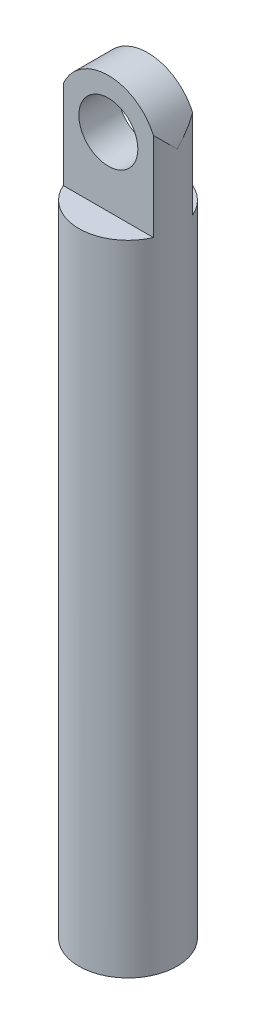
from build123d import *

# Parameters (mm, degrees)
SKETCH_1_R               = 2.5
EXTRUDE_1_DEPTH          = 38.5
CUT_EXTRUDE_1_DEPTH      = 39.661996844
CUT_EXTRUDE_1_DEPTH_BACK = 39.661996844
CUT_EXTRUDE_2_DEPTH      = 39.661996957
CUT_EXTRUDE_2_DEPTH_BACK = 39.661996957
SKETCH_3_W               = 1.5
SKETCH_3_H               = 6


with BuildPart() as part:
    # 草图1 → 凸台-拉伸1 (new body)
    with BuildSketch(Plane(origin=(0, 0, 0), x_dir=(1, 0, 0), z_dir=(0, 1, 0))):
        with Locations(Location((0, 0, 0), (0, 0, 270))):
            Circle(SKETCH_1_R)
    extrude(amount=EXTRUDE_1_DEPTH)

    # 草图2 → 切除-拉伸1 (cut, two sides: drawn at the far end of the back side and taken through both)
    with BuildSketch(Plane.XY.offset(-CUT_EXTRUDE_1_DEPTH_BACK)):
        with BuildLine():
            ThreePointArc((-2.5, 36), (-1.767766953, 37.767766953), (0, 38.5))
            Line((0, 38.5), (-2.5, 38.5))
            Line((-2.5, 38.5), (-2.5, 36))
        make_face()
        with BuildLine():
            Line((2.5, 38.5), (0, 38.5))
            ThreePointArc((0, 38.5), (1.767766953, 37.767766953), (2.5, 36))
            Line((2.5, 36), (2.5, 38.5))
        make_face()
        with BuildLine():
            ThreePointArc((1.5, 36), (1.060660172, 37.060660172), (0, 37.5))
            Line((0, 37.5), (0, 34.5))
            ThreePointArc((0, 34.5), (1.060660172, 34.939339828), (1.5, 36))
        make_face()
        with BuildLine():
            Line((0, 34.5), (0, 37.5))
            ThreePointArc((0, 37.5), (-1.5, 36), (0, 34.5))
        make_face()
    extrude(amount=CUT_EXTRUDE_1_DEPTH + CUT_EXTRUDE_1_DEPTH_BACK, mode=Mode.SUBTRACT)

    # 草图3 → 切除-拉伸2 (cut, two sides: drawn at the far end of the back side and taken through both)
    with BuildSketch(Plane(origin=(0, 0, 0), x_dir=(0, 0, -1), z_dir=(1, 0, 0)).offset(-CUT_EXTRUDE_2_DEPTH_BACK)):
        with Locations((-1.75, 35.5)):
            Rectangle(SKETCH_3_W, SKETCH_3_H)
        with Locations((1.75, 35.5)):
            Rectangle(SKETCH_3_W, SKETCH_3_H)
    extrude(amount=CUT_EXTRUDE_2_DEPTH + CUT_EXTRUDE_2_DEPTH_BACK, mode=Mode.SUBTRACT)


solid = part.part
